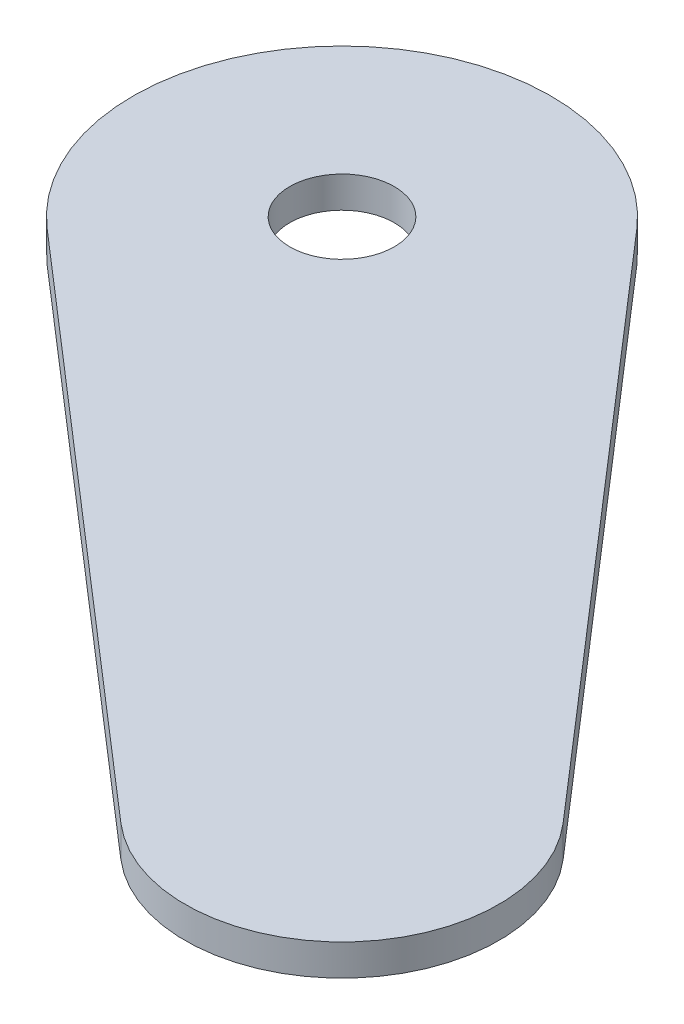
from build123d import *

# Parameters (mm, degrees)
SKETCH_1_R          = 20
SKETCH_1_R_2        = 15
EXTRUDE_1_DEPTH     = 3
SKETCH_2_R          = 2.5
CUT_EXTRUDE_1_DEPTH = 92.262525064
SKETCH_3_R          = 5
CUT_EXTRUDE_2_DEPTH = 10


with BuildPart() as part:
    # 草图1 → 凸台-拉伸1 (new body)
    with BuildSketch(Plane(origin=(0, 0, 0), x_dir=(1, 0, 0), z_dir=(0, 1, 0))):
        Circle(SKETCH_1_R)
        with BuildLine():
            ThreePointArc((20, 0), (8.309115435, -18.192267607), (-13.095860068, -15.116165158))
            Line((-13.095860068, -15.116165158), (39.675579632, -60.834598551))
            ThreePointArc((39.675579632, -60.834598551), (38.890872965, -38.890872965), (60.834598551, -39.675579632))
            Line((60.834598551, -39.675579632), (15.116165158, 13.095860068))
            ThreePointArc((15.116165158, 13.095860068), (18.73930766, 6.98844392), (20, 0))
        make_face()
        with Locations((49.497474683, -49.497474683)):
            Circle(SKETCH_1_R_2)
    extrude(amount=EXTRUDE_1_DEPTH)

    # 草图2 → 切除-拉伸1 (cut, through all)
    with BuildSketch(Plane(origin=(0, 3, 0), x_dir=(1, 0, 0), z_dir=(0, 1, 0))):
        with Locations(Location((0, 0, 0), (0, 0, 270))):
            Circle(SKETCH_2_R)
    extrude(amount=-CUT_EXTRUDE_1_DEPTH, mode=Mode.SUBTRACT)

    # 草图3 → 切除-拉伸2 (cut)
    with BuildSketch(Plane(origin=(0, 3, 0), x_dir=(1, 0, 0), z_dir=(0, 1, 0))):
        with Locations(Location((0, 0, 0), (0, 0, 270))):
            Circle(SKETCH_3_R)
    extrude(amount=-CUT_EXTRUDE_2_DEPTH, mode=Mode.SUBTRACT)


solid = part.part
